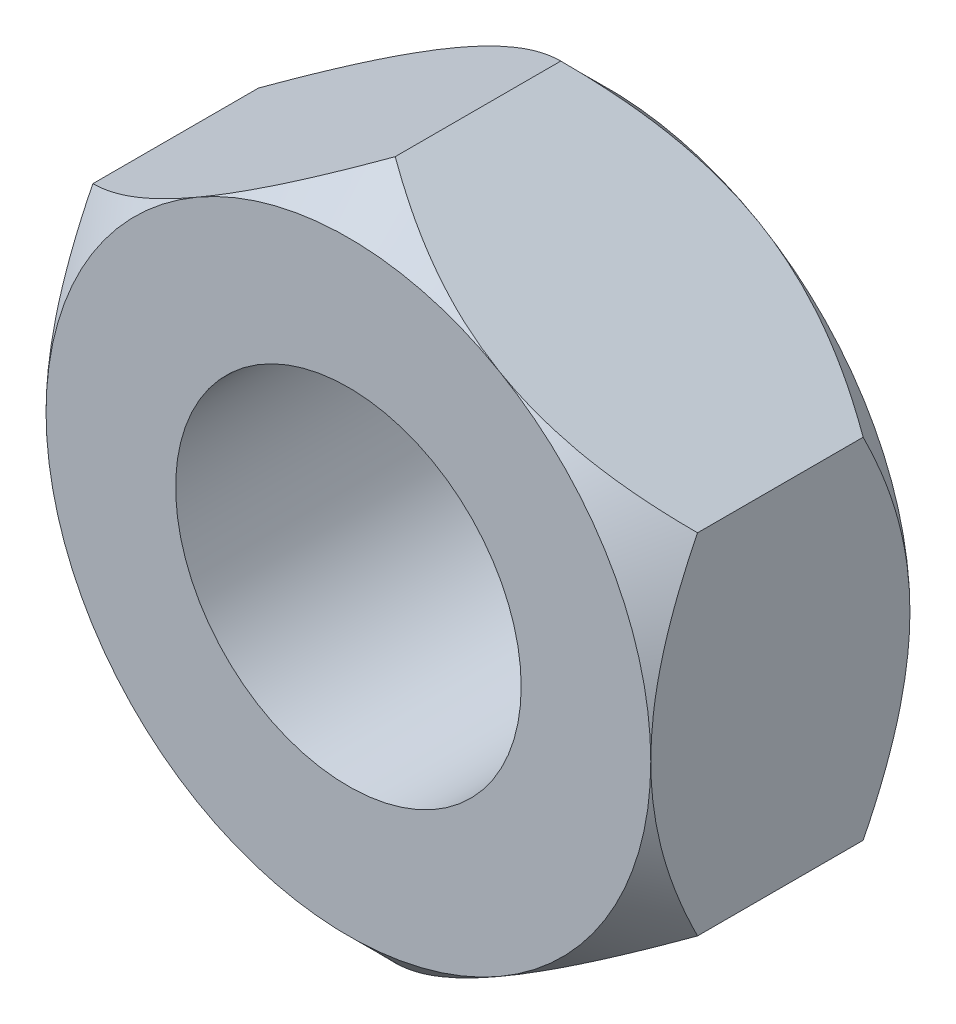
from build123d import *

# Parameters (mm, degrees)
SKETCH1_R               = 2
BOSS_EXTRUDE1_DEPTH     = 3
SKETCH2_OUTSIDE_W       = 17.222
SKETCH2_OUTSIDE_H       = 18.304
SKETCH2_OUTSIDE_R       = 3.5
CUT_EXTRUDE1_DEPTH      = 3
CUT_EXTRUDE1_DRAFT      = -45
MIRROR1_COPY_1_SKETCH_W = 17.222
MIRROR1_COPY_1_SKETCH_H = 18.304
MIRROR1_COPY_1_SKETCH_R = 3.5
MIRROR1_COPY_1_DEPTH    = 3
MIRROR1_COPY_1_DRAFT    = -45


with BuildPart() as part:
    # Sketch1 → Boss-Extrude1 (new body)
    with BuildSketch(Plane.XY):
        Polygon((3.5, 2.020725942), (0, 4.041451884), (-3.5, 2.020725942), (-3.5, -2.020725942), (0, -4.041451884), (3.5, -2.020725942), align=None)
        Circle(SKETCH1_R, mode=Mode.SUBTRACT)
    extrude(amount=BOSS_EXTRUDE1_DEPTH)


with BuildPart() as cut_extrude1_tool:
    # Sketch2 outside → Cut-Extrude1 (with draft: the straight prism first)
    with BuildSketch(Plane.XY.offset(3)):
        Rectangle(SKETCH2_OUTSIDE_W, SKETCH2_OUTSIDE_H)
        Circle(SKETCH2_OUTSIDE_R, mode=Mode.SUBTRACT)
    extrude(amount=-CUT_EXTRUDE1_DEPTH)
    # Cut-Extrude1: the draft: its side faces are tilted about the plane it starts from
    cut_extrude1_sides = [cut_extrude1_tool.faces().sort_by_distance(p)[0] for p in [
        (0, -9.152, 1.5),
        (8.611, 0, 1.5),
        (0, 9.152, 1.5),
        (-8.611, 0, 1.5),
        (-3.5, 0, 1.5),
    ]]
    draft(cut_extrude1_sides, Plane.XY.offset(3), CUT_EXTRUDE1_DRAFT)


with BuildPart() as part_1:
    add(part.part)

    # Cut-Extrude1: cut by cut_extrude1_tool
    add(cut_extrude1_tool.part, mode=Mode.SUBTRACT)


with BuildPart() as mirror1_copy_1_tool:
    # Mirror1 copy 1 sketch → Mirror1 copy 1 (with draft: the straight prism first)
    with BuildSketch(Plane(origin=(0, 0, 0), x_dir=(1, 0, 0), z_dir=(0, 0, -1))):
        Rectangle(MIRROR1_COPY_1_SKETCH_W, MIRROR1_COPY_1_SKETCH_H)
        Circle(MIRROR1_COPY_1_SKETCH_R, mode=Mode.SUBTRACT)
    extrude(amount=-MIRROR1_COPY_1_DEPTH)
    # Mirror1 copy 1: the draft: its side faces are tilted about the plane it starts from
    mirror1_copy_1_sides = [mirror1_copy_1_tool.faces().sort_by_distance(p)[0] for p in [
        (0, -9.152, 1.5),
        (8.611, 0, 1.5),
        (0, 9.152, 1.5),
        (-8.611, 0, 1.5),
        (-3.5, 0, 1.5),
    ]]
    draft(mirror1_copy_1_sides, Plane(origin=(0, 0, 0), x_dir=(1, 0, 0), z_dir=(0, 0, -1)), MIRROR1_COPY_1_DRAFT)


with BuildPart() as part_2:
    add(part_1.part)

    # Mirror1 copy 1: cut by mirror1_copy_1_tool
    add(mirror1_copy_1_tool.part, mode=Mode.SUBTRACT)


solid = part_2.part
